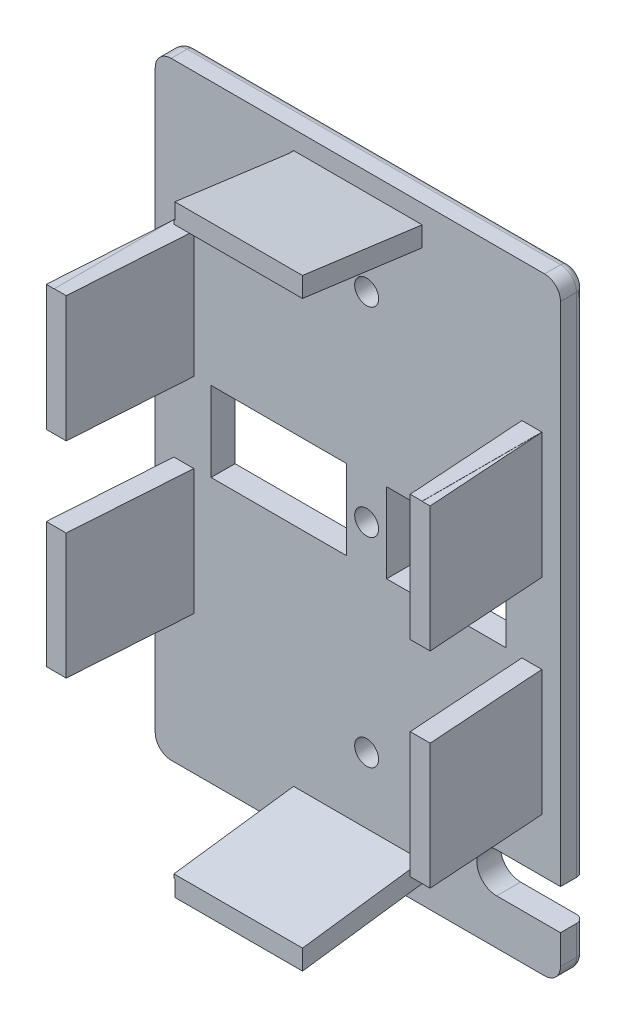
from build123d import *

# Parameters (mm, degrees)
CROQUIS1_W              = 50.8
CROQUIS1_H              = 76.2
SALIENTE_EXTRUIR1_DEPTH = 18
CROQUIS2_W              = 50.8
CROQUIS2_H              = 76.2
CROQUIS2_W_2            = 46.12
CROQUIS2_H_2            = 71.52
CROQUIS2_W_3            = 38.8
CROQUIS2_H_3            = 64.2
CORTAR_EXTRUIR1_DEPTH   = 15
CORTAR_EXTRUIR8_DEPTH   = 15
SALIENTE_EXTRUIR3_DEPTH = 41.5
CORTAR_EXTRUIR9_DEPTH   = 51.5
CORTAR_EXTRUIR10_DEPTH  = 51.5
SALIENTE_EXTRUIR4_DEPTH = 16
CORTAR_EXTRUIR11_DEPTH  = 16.5
REDONDEO3_R             = 2
REDONDEO4_R             = 1
CROQUIS15_W             = 48.12
CROQUIS15_H             = 10
CORTAR_EXTRUIR12_DEPTH  = 15
CROQUIS16_W             = 8
CROQUIS16_H             = 1.5
CORTAR_EXTRUIR13_DEPTH  = 2
CROQUIS18_R             = 1.5
CROQUIS18_W             = 17
CROQUIS18_H             = 10
CROQUIS18_W_2           = 15
CORTAR_EXTRUIR15_DEPTH  = 3
CORTAR_EXTRUIR16_DEPTH  = 10


with BuildPart() as part:
    # Croquis1 → Saliente-Extruir1 (new body)
    with BuildSketch(Plane.XY):
        Rectangle(CROQUIS1_W, CROQUIS1_H)
    extrude(amount=SALIENTE_EXTRUIR1_DEPTH)

    # Croquis2 → Cortar-Extruir1 (cut)
    # profile 1 of 2: a face of its own
    with BuildSketch(Plane.XY.offset(18)):
        Rectangle(CROQUIS2_W, CROQUIS2_H)
        Rectangle(CROQUIS2_W_2, CROQUIS2_H_2, mode=Mode.SUBTRACT)
    # profile 2 of 2: a face of its own
    with BuildSketch(Plane.XY.offset(18)):
        Rectangle(CROQUIS2_W_3, CROQUIS2_H_3)
    extrude(amount=-CORTAR_EXTRUIR1_DEPTH, mode=Mode.SUBTRACT)

    # Croquis6 → Cortar-Extruir8 (cut)
    with BuildSketch(Plane.XY.offset(18)):
        Polygon((-23.06, 35.76), (-8.06, 35.76), (-8.06, 32.1), (-19.4, 32.1), (-19.4, 20.76), (-23.06, 20.76), align=None)
        Polygon((23.06, 35.76), (8.06, 35.76), (8.06, 32.1), (19.4, 32.1), (19.4, 20.76), (23.06, 20.76), align=None)
        Polygon((-23.06, -35.76), (-23.06, -20.76), (-19.4, -20.76), (-19.4, -32.1), (-8.06, -32.1), (-8.06, -35.76), align=None)
        Polygon((23.06, -35.76), (8.06, -35.76), (8.06, -32.1), (19.4, -32.1), (19.4, -20.76), (23.06, -20.76), align=None)
    extrude(amount=-CORTAR_EXTRUIR8_DEPTH, mode=Mode.SUBTRACT)

    # Croquis10 → Saliente-Extruir3 (add)
    with BuildSketch(Plane(origin=(0, -20.76, 0), x_dir=(-1, 0, 0), z_dir=(0, -1, 0))):
        Polygon((23.06, -18), (24.06, -18), (23.06, -3), align=None)
        Polygon((-23.06, -18), (-24.06, -18), (-23.06, -3), align=None)
    extrude(amount=-SALIENTE_EXTRUIR3_DEPTH)

    # Croquis11 → Cortar-Extruir9 (cut)
    with BuildSketch(Plane.XZ.offset(20.76)):
        Polygon((-19.4, 18), (-21.56, 18), (-20.56, 3), (-19.4, 3), align=None)
    extrude(amount=-CORTAR_EXTRUIR9_DEPTH, mode=Mode.SUBTRACT)

    # Croquis12 → Cortar-Extruir10 (cut)
    with BuildSketch(Plane.XZ.offset(20.76)):
        Polygon((19.4, 18), (19.4, 3), (20.56, 3), (21.56, 18), align=None)
    extrude(amount=-CORTAR_EXTRUIR10_DEPTH, mode=Mode.SUBTRACT)

    # Croquis13 → Saliente-Extruir4 (add)
    with BuildSketch(Plane(origin=(8.06, 0, 0), x_dir=(0, 0, -1), z_dir=(1, 0, 0))):
        Polygon((-18, -35.76), (-18, -37.76), (-3, -35.76), align=None)
        Polygon((-18, 35.76), (-18, 37.76), (-3, 35.76), align=None)
    extrude(amount=-SALIENTE_EXTRUIR4_DEPTH)

    # Croquis14 → Cortar-Extruir11 (cut)
    with BuildSketch(Plane(origin=(8.06, 0, 0), x_dir=(0, 0, -1), z_dir=(1, 0, 0))):
        Polygon((-3, -32.1), (-18, -32.1), (-18, -35.26), (-3, -33.26), align=None)
        Polygon((-18, 32.1), (-18, 35.26), (-3, 33.26), (-3, 32.1), align=None)
    extrude(amount=-CORTAR_EXTRUIR11_DEPTH, mode=Mode.SUBTRACT)

    # Redondeo3
    redondeo3_edges = [part.edges().sort_by_distance(p)[0] for p in [
        (-25.4, 38.1, 1.5),
        (25.4, 38.1, 1.5),
        (25.4, -38.1, 1.5),
        (-25.4, -38.1, 1.5),
    ]]
    fillet(redondeo3_edges, radius=REDONDEO3_R)

    # Redondeo4
    redondeo4_edges = [part.edges().sort_by_distance(p)[0] for p in [
        (0, 38.1, 0),
        (-25.4, 0, 0),
        (25.4, 0, 0),
        (0, -38.1, 0),
        (24.814213562, -37.514213562, 0),
        (-24.814213562, -37.514213562, 0),
        (-24.814213562, 37.514213562, 0),
        (24.814213562, 37.514213562, 0),
    ]]
    fillet(redondeo4_edges, radius=REDONDEO4_R)

    # Croquis15 → Cortar-Extruir12 (cut)
    with BuildSketch(Plane.XY.offset(18)):
        with Locations((0, -0.01)):
            Rectangle(CROQUIS15_W, CROQUIS15_H)
    extrude(amount=-CORTAR_EXTRUIR12_DEPTH, mode=Mode.SUBTRACT)

    # Croquis16 → Cortar-Extruir13 (cut)
    with BuildSketch(Plane.XZ.offset(38.1)):
        with Locations((0, 2.25)):
            Rectangle(CROQUIS16_W, CROQUIS16_H)
    extrude(amount=-CORTAR_EXTRUIR13_DEPTH, mode=Mode.SUBTRACT)

    # Croquis18 → Cortar-Extruir15 (cut)
    with BuildSketch(Plane.XY.offset(3)):
        with Locations((1.1, 0)):
            Circle(CROQUIS18_R)
        with Locations((1.1, 25)):
            Circle(CROQUIS18_R)
        with Locations((1.1, -25)):
            Circle(CROQUIS18_R)
        with Locations((-9.9, 0.1)):
            Rectangle(CROQUIS18_W, CROQUIS18_H)
        with Locations((11.1, 0.1)):
            Rectangle(CROQUIS18_W_2, CROQUIS18_H)
    extrude(amount=-CORTAR_EXTRUIR15_DEPTH, mode=Mode.SUBTRACT)

    # Croquis19 → Cortar-Extruir16 (cut)
    with BuildSketch(Plane.XY.offset(3)):
        with BuildLine():
            Line((25.4, -32.419906808), (17.4, -32.419906808))
            ThreePointArc((17.4, -32.419906808), (14.9, -29.919906808), (17.4, -27.419906808))
            Line((17.4, -27.419906808), (25.4, -27.419906808))
            ThreePointArc((25.4, -27.419906808), (27.9, -29.919906808), (25.4, -32.419906808))
        make_face()
    extrude(amount=-CORTAR_EXTRUIR16_DEPTH, mode=Mode.SUBTRACT)


solid = part.part
